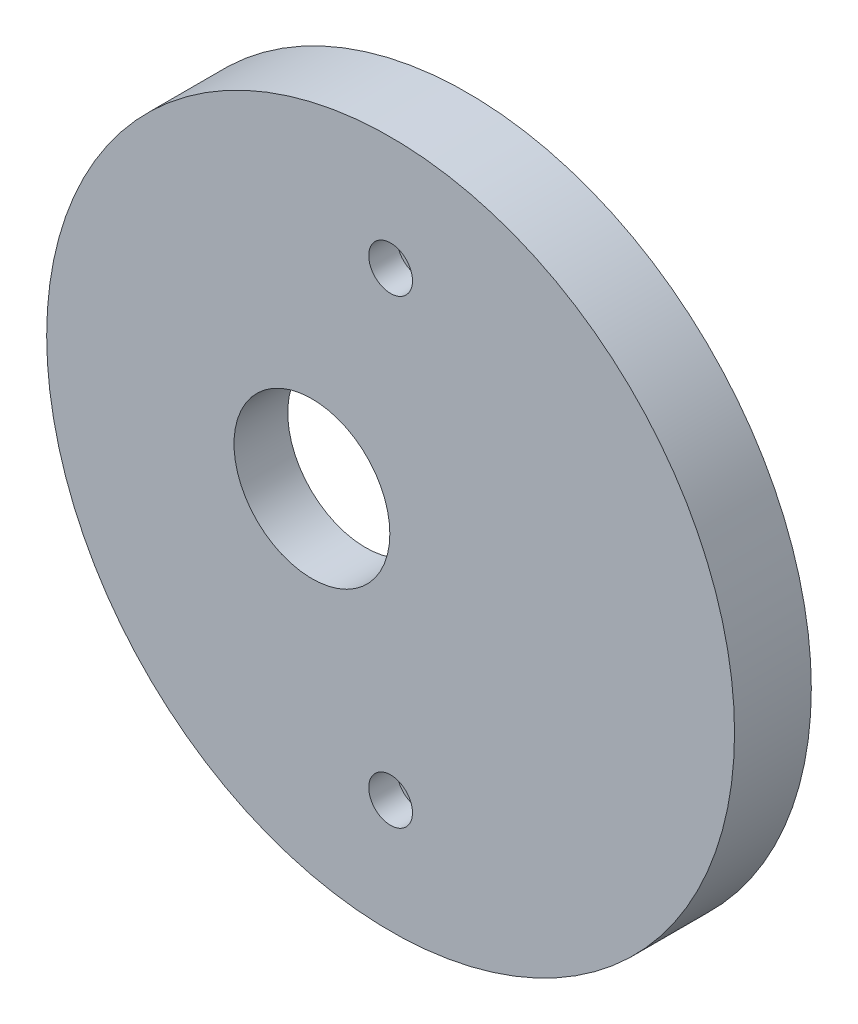
from build123d import *

# Parameters (mm, degrees)
ESQUISSE1_R             = 44.8
ESQUISSE1_R_2           = 10.15
ESQUISSE1_R_3           = 1.8
BOSS_EXTRU_1_DEPTH      = 7
BOSS_EXTRU_2_START      = 3
ESQUISSE3_R             = 44.8
ESQUISSE3_R_2           = 33.5
BOSS_EXTRU_2_DEPTH      = 3
ESQUISSE4_R             = 2.85
ENL_V_MAT_EXTRU_3_DEPTH = 3.7


with BuildPart() as part:
    # Esquisse1 → Boss.-Extru.1 (new body)
    with BuildSketch(Plane.XY):
        Circle(ESQUISSE1_R)
        with Locations((-10.25, 0)):
            Circle(ESQUISSE1_R_2, mode=Mode.SUBTRACT)
        with Locations((0, 30)):
            Circle(ESQUISSE1_R_3, mode=Mode.SUBTRACT)
        with Locations(Location((0, -30, 0), (0, 0, 180))):
            Circle(ESQUISSE1_R_3, mode=Mode.SUBTRACT)
    extrude(amount=BOSS_EXTRU_1_DEPTH)

    # Esquisse3 → Boss.-Extru.2 (add)
    with BuildSketch(Plane(origin=(0, 0, 0), x_dir=(-1, 0, 0), z_dir=(0, 0, -1)).offset(BOSS_EXTRU_2_START)):
        Circle(ESQUISSE3_R)
        Circle(ESQUISSE3_R_2, mode=Mode.SUBTRACT)
    extrude(amount=-BOSS_EXTRU_2_DEPTH)

    # Esquisse4 → Enlèv. mat.-Extru.3 (cut)
    with BuildSketch(Plane.XY.offset(7)):
        with Locations((0, 30)):
            Circle(ESQUISSE4_R)
        with Locations((0, -30)):
            Circle(ESQUISSE4_R)
    extrude(amount=-ENL_V_MAT_EXTRU_3_DEPTH, mode=Mode.SUBTRACT)


solid = part.part
